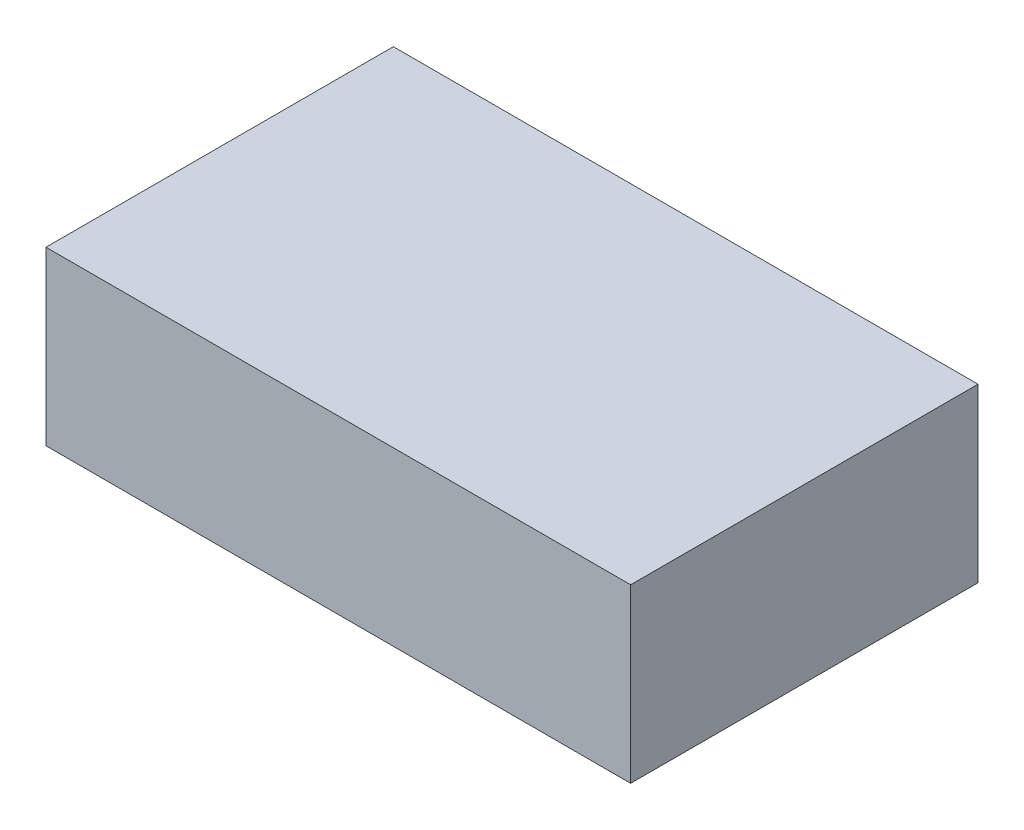
from build123d import *

# Parameters (mm, degrees)
SKETCH1_W           = 85
SKETCH1_H           = 50.5
BOSS_EXTRUDE1_DEPTH = 25


with BuildPart() as part:
    # Sketch1 → Boss-Extrude1 (new body)
    with BuildSketch(Plane(origin=(0, 0, 0), x_dir=(1, 0, 0), z_dir=(0, 1, 0))):
        with Locations((42.5, 25.25)):
            Rectangle(SKETCH1_W, SKETCH1_H)
    extrude(amount=BOSS_EXTRUDE1_DEPTH)


solid = part.part
